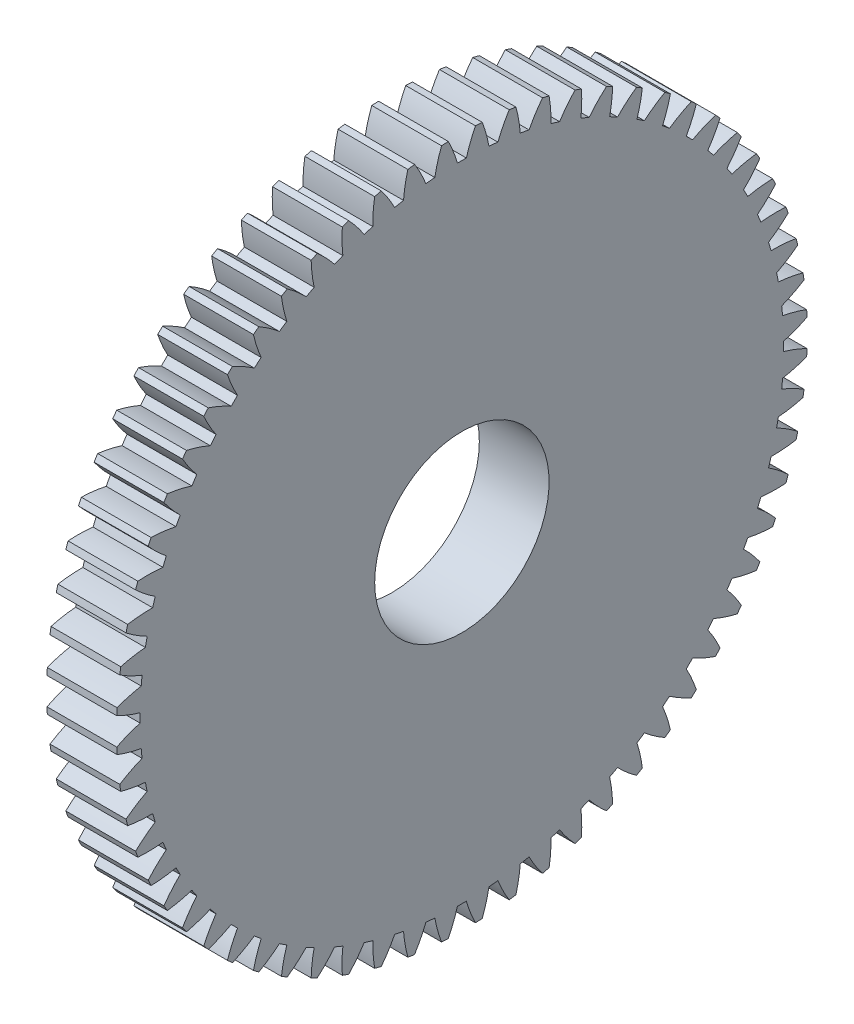
from build123d import *

# Parameters (mm, degrees)
BASPROSKE_W     = 4
BASPROSKE_H     = 19.8
TOOTHCUT_DEPTH  = 29.285685426
TEETHCUTS_COUNT = 64
TEETHCUTS_ANGLE = 354.375
BORSKE_R        = 5
BORE_DEPTH      = 50.0000508


with BuildPart() as part:
    # BasProSke → Base-Revolve (revolve)
    with BuildSketch(Plane(origin=(0, 0, 0), x_dir=(1, 0, 0), z_dir=(0, 1, 0)), mode=Mode.PRIVATE) as base_revolve_sk:
        with Locations((2, 9.9)):
            Rectangle(BASPROSKE_W, BASPROSKE_H)
    revolve(base_revolve_sk.sketch.rotate(Axis((-10, 0, 0), (1, 0, 0)), 180), axis=Axis((-10, 0, 0), (1, 0, 0)))

    # TooCutSke → ToothCut (cut, through all)
    with BuildSketch(Plane(origin=(0, 0, 0), x_dir=(0, 0, -1), z_dir=(1, 0, 0))):
        with BuildLine():
            ThreePointArc((0.256887834, 18.447211433), (0, 18.449), (-0.256887834, 18.447211433))
            ThreePointArc((-0.256887834, 18.447211433), (-0.490865906, 19.141155369), (-0.789876137, 19.809658777))
            ThreePointArc((-0.789876137, 19.809658777), (0, 19.8254), (0.789876137, 19.809658777))
            ThreePointArc((0.789876137, 19.809658777), (0.490865906, 19.141155369), (0.256887834, 18.447211433))
        make_face()
    toothcut = extrude(amount=TOOTHCUT_DEPTH, mode=Mode.SUBTRACT)

    # TeethCuts: ToothCut ×64 about axis
    teethcuts_axis = Axis((-10, 0, 0), (1, 0, 0))
    for i in range(1, TEETHCUTS_COUNT):
        add(toothcut.rotate(teethcuts_axis, i * TEETHCUTS_ANGLE / (TEETHCUTS_COUNT - 1)), mode=Mode.SUBTRACT)

    # BorSke → Bore (cut, symmetric)
    with BuildSketch(Plane(origin=(0, 0, 0), x_dir=(0, 0, -1), z_dir=(1, 0, 0))):
        with Locations(Location((0, 0, 0), (0, 0, 180))):
            Circle(BORSKE_R)
    extrude(amount=BORE_DEPTH, both=True, mode=Mode.SUBTRACT)


solid = part.part
